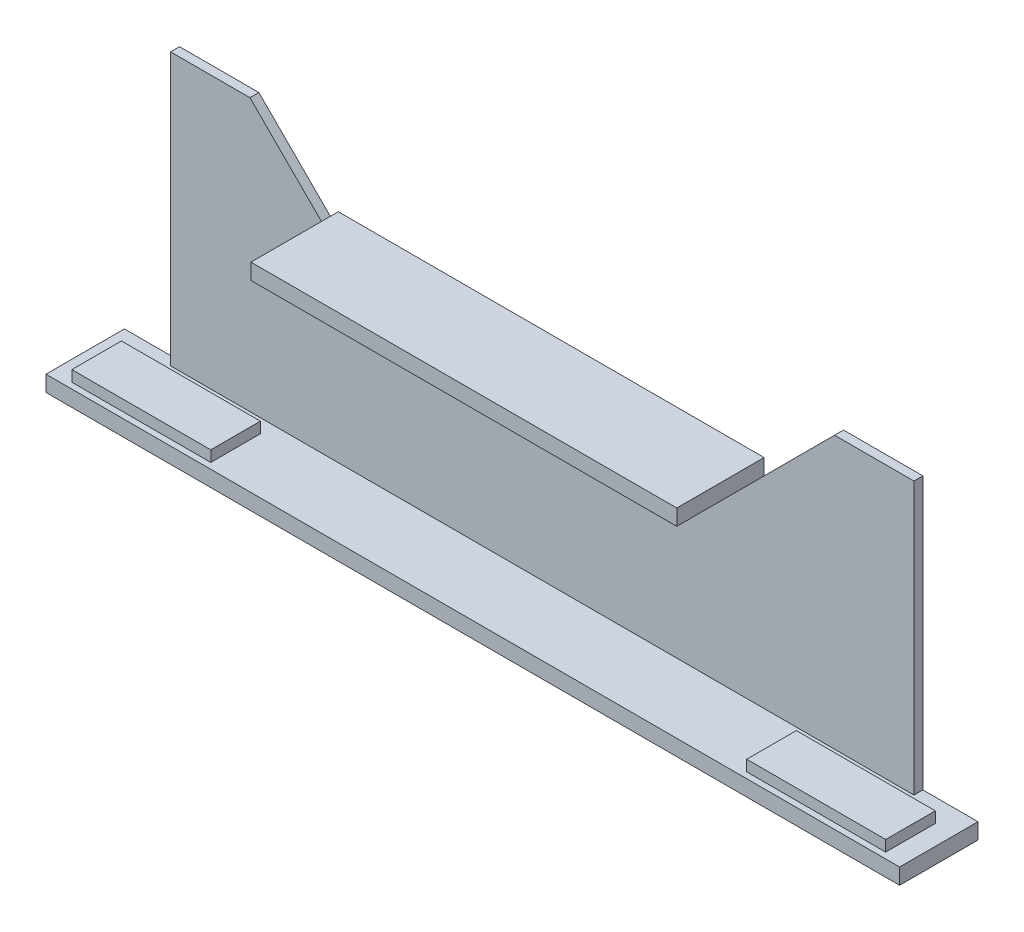
from build123d import *

# Parameters (mm, degrees)
SKETCH_1_R             = 13
EXTRUDE_2_DEPTH        = 9
SKETCH_3_W             = 860
SKETCH_3_H             = 16
EXTRUDE_3_DEPTH        = 70
SKETCH_4_W             = 140
SKETCH_4_H             = 50
EXTRUDE_5_DEPTH        = 11
SKETCH_5_R             = 13
CUT_EXTRUDE_2_DEPTH    = 903.779042734
PATTERN_LINEAR_1_COUNT = 2
PATTERN_LINEAR_1_PITCH = 80
SKETCH_6_W             = 140
SKETCH_6_H             = 50
EXTRUDE_6_DEPTH        = 6
SKETCH_7_R             = 13
CUT_EXTRUDE_3_DEPTH    = 905.248306606
PATTERN_LINEAR_2_COUNT = 2
PATTERN_LINEAR_2_PITCH = 80
SKETCH_10_W            = 429
SKETCH_10_H            = 16
EXTRUDE_8_DEPTH        = 79
EXTRUDE_9_DEPTH        = 9
SKETCH_12_W            = 140
SKETCH_12_H            = 50
EXTRUDE_10_DEPTH       = 27


with BuildPart() as part:
    # 草图1 → 凸台-拉伸2 (new body)
    with BuildSketch(Plane.XY):
        Polygon((0, 0), (860, 0), (860, 16), (804.5, 16), (804.5, 290), (724.5, 290), (644.5, 210), (644.5, 226), (215.5, 226), (215.5, 210), (135.5, 290), (55.5, 290), (55.5, 16), (0, 16), align=None)
        with Locations((95.5, 90)):
            Circle(SKETCH_1_R, mode=Mode.SUBTRACT)
        with Locations((95.5, 170)):
            Circle(SKETCH_1_R, mode=Mode.SUBTRACT)
        with Locations((95.5, 250)):
            Circle(SKETCH_1_R, mode=Mode.SUBTRACT)
        with Locations((764.5, 90)):
            Circle(SKETCH_1_R, mode=Mode.SUBTRACT)
        with Locations((764.5, 170)):
            Circle(SKETCH_1_R, mode=Mode.SUBTRACT)
        with Locations((764.5, 250)):
            Circle(SKETCH_1_R, mode=Mode.SUBTRACT)
    extrude(amount=EXTRUDE_2_DEPTH)

    # 草图3 → 凸台-拉伸3 (add)
    with BuildSketch(Plane.XY.offset(9)):
        with Locations((430, 8)):
            Rectangle(SKETCH_3_W, SKETCH_3_H)
    extrude(amount=EXTRUDE_3_DEPTH)

    # 草图4 → 凸台-拉伸5 (add)
    with BuildSketch(Plane(origin=(0, 16, 0), x_dir=(1, 0, 0), z_dir=(0, 1, 0))):
        with Locations((90, -48)):
            Rectangle(SKETCH_4_W, SKETCH_4_H)
    extrude(amount=EXTRUDE_5_DEPTH)

    # 草图5 → 切除-拉伸2 (cut, through all)
    with BuildSketch(Plane(origin=(0, 27, 0), x_dir=(1, 0, 0), z_dir=(0, 1, 0))):
        with Locations(Location((40, -48, 0), (0, 0, 270))):
            Circle(SKETCH_5_R)
    cut_extrude_2 = extrude(amount=-CUT_EXTRUDE_2_DEPTH, mode=Mode.SUBTRACT)

    # 阵列(线性)1: 切除-拉伸2 ×2
    with Locations(*[(i * PATTERN_LINEAR_1_PITCH, 0, 0) for i in range(1, PATTERN_LINEAR_1_COUNT)]):
        add(cut_extrude_2, mode=Mode.SUBTRACT)

    # 草图6 → 凸台-拉伸6 (add)
    with BuildSketch(Plane(origin=(0, 16, 0), x_dir=(1, 0, 0), z_dir=(0, 1, 0))):
        with Locations((770, -48)):
            Rectangle(SKETCH_6_W, SKETCH_6_H)
    extrude(amount=EXTRUDE_6_DEPTH)

    # 草图7 → 切除-拉伸3 (cut, through all)
    with BuildSketch(Plane(origin=(0, 22, 0), x_dir=(1, 0, 0), z_dir=(0, 1, 0))):
        with Locations(Location((820, -48, 0), (0, 0, 270))):
            Circle(SKETCH_7_R)
    cut_extrude_3 = extrude(amount=-CUT_EXTRUDE_3_DEPTH, mode=Mode.SUBTRACT)

    # 阵列(线性)2: 切除-拉伸3 ×2
    with Locations(*[(-i * PATTERN_LINEAR_2_PITCH, 0, 0) for i in range(1, PATTERN_LINEAR_2_COUNT)]):
        add(cut_extrude_3, mode=Mode.SUBTRACT)

    # 草图10 → 凸台-拉伸8 (add)
    with BuildSketch(Plane.XY.offset(9)):
        with Locations((430, 218)):
            Rectangle(SKETCH_10_W, SKETCH_10_H)
    extrude(amount=EXTRUDE_8_DEPTH)

    # 草图11 → 凸台-拉伸9 (add)
    with BuildSketch(Plane.XY.offset(9)):
        Polygon((55.5, 290), (135.5, 290), (215.5, 210), (644.5, 210), (724.5, 290), (804.5, 290), (804.5, 16), (55.5, 16), align=None)
    extrude(amount=-EXTRUDE_9_DEPTH)

    # 草图12 → 凸台-拉伸10 (add)
    with BuildSketch(Plane(origin=(0, 27, 0), x_dir=(1, 0, 0), z_dir=(0, 1, 0))):
        with Locations((90, -48)):
            Rectangle(SKETCH_12_W, SKETCH_12_H)
        with Locations((770, -48)):
            Rectangle(SKETCH_12_W, SKETCH_12_H)
    extrude(amount=-EXTRUDE_10_DEPTH)


solid = part.part
